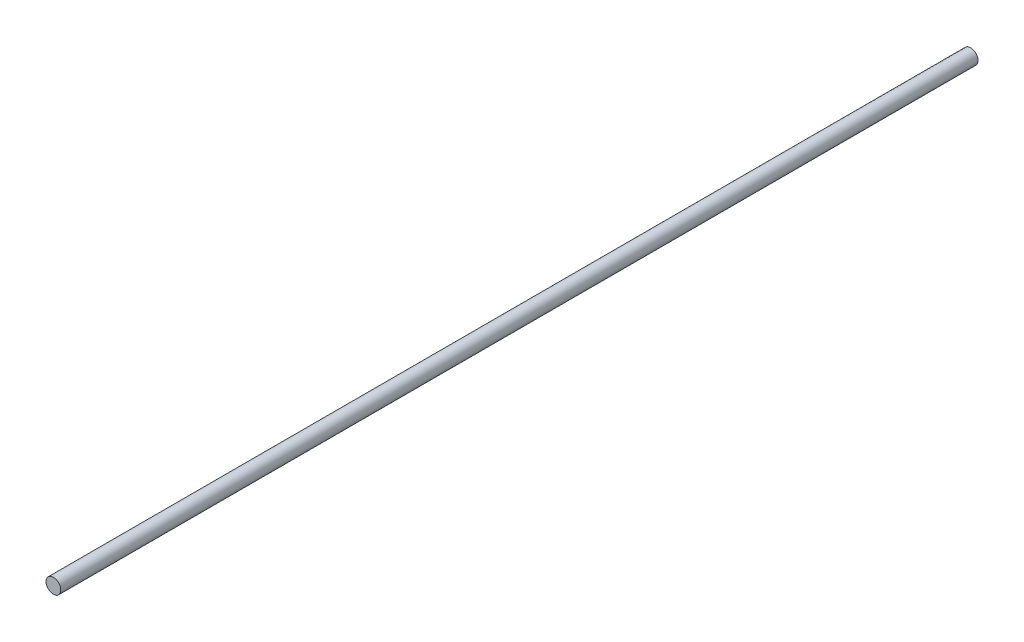
from build123d import *

# Parameters (mm, degrees)
SKETCH_1_R           = 2
CABLE_ENVELOPE_DEPTH = 248.772918341


with BuildPart() as part:
    # 草图1 → Cable_envelope (new body)
    with BuildSketch(Plane.XY):
        with Locations(Location((0, 0, 0), (0, 0, 180))):
            Circle(SKETCH_1_R)
    extrude(amount=CABLE_ENVELOPE_DEPTH)


solid = part.part
